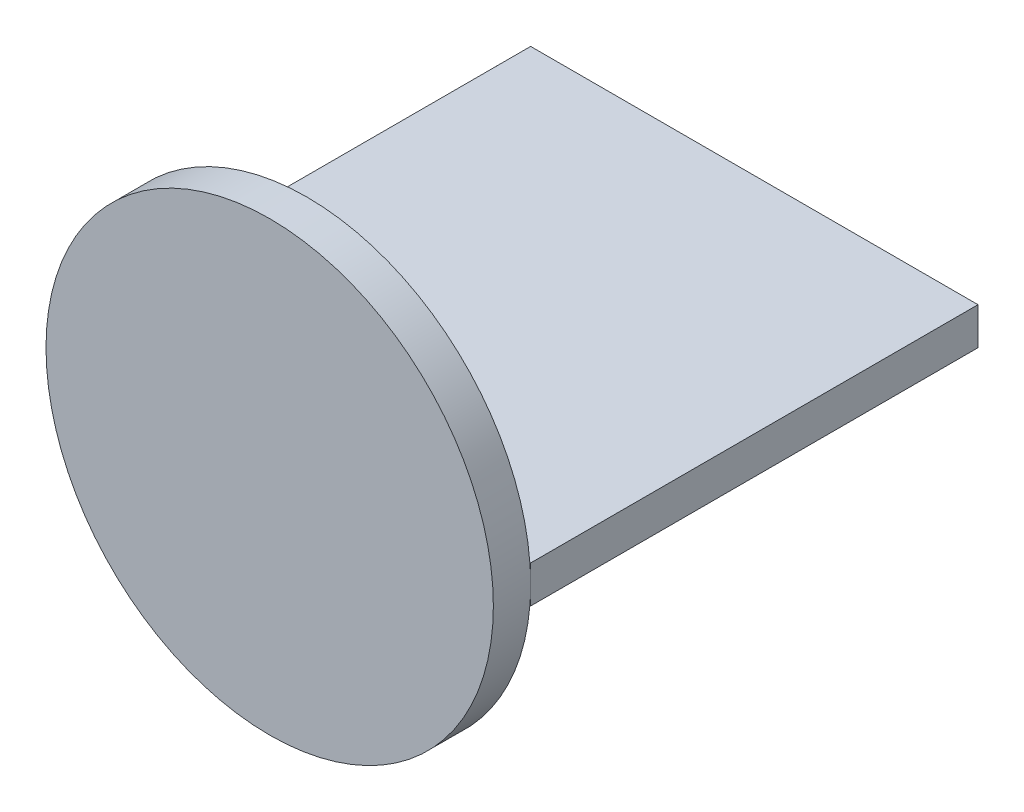
from build123d import *

# Parameters (mm, degrees)
SKETCH_1_R          = 30
SKETCH_1_R_2        = 13.5
SKETCH_1_R_3        = 1.880556804
EXTRUDE_1_DEPTH     = 10
SKETCH_2_W          = 60
SKETCH_2_H          = 5
EXTRUDE_2_DEPTH     = 60
CUT_EXTRUDE_START   = -5
SKETCH_7_R          = 30
CUT_EXTRUDE_4_DEPTH = 5


with BuildPart() as part:
    # 草图1 → 凸台-拉伸1 (new body)
    # profile 1 of 5: a face of its own
    with BuildSketch(Plane.XY):
        Circle(SKETCH_1_R)
        Circle(SKETCH_1_R_2, mode=Mode.SUBTRACT)
    # profile 2 of 5: a face of its own
    with BuildSketch(Plane.XY):
        Circle(SKETCH_1_R_2)
    # profile 3 of 5: a face of its own
    with BuildSketch(Plane.XY):
        with Locations((0, 13.5)):
            Circle(SKETCH_1_R_3)
    # profile 4 of 5: a face of its own
    with BuildSketch(Plane.XY):
        with Locations((-11.691342951, -6.75)):
            Circle(SKETCH_1_R_3)
    # profile 5 of 5: a face of its own
    with BuildSketch(Plane.XY):
        with Locations((11.691342951, -6.75)):
            Circle(SKETCH_1_R_3)
    extrude(amount=EXTRUDE_1_DEPTH)

    # 草图2 → 凸台-拉伸2 (add)
    with BuildSketch(Plane(origin=(0, 0, 0), x_dir=(-1, 0, 0), z_dir=(0, 0, -1))):
        Rectangle(SKETCH_2_W, SKETCH_2_H)
    extrude(amount=EXTRUDE_2_DEPTH)

    # 草图7 → 切除-拉伸4 (cut)
    with BuildSketch(Plane.XY.offset(10).offset(CUT_EXTRUDE_START)):
        Circle(SKETCH_7_R)
    extrude(amount=CUT_EXTRUDE_4_DEPTH, mode=Mode.SUBTRACT)


solid = part.part
